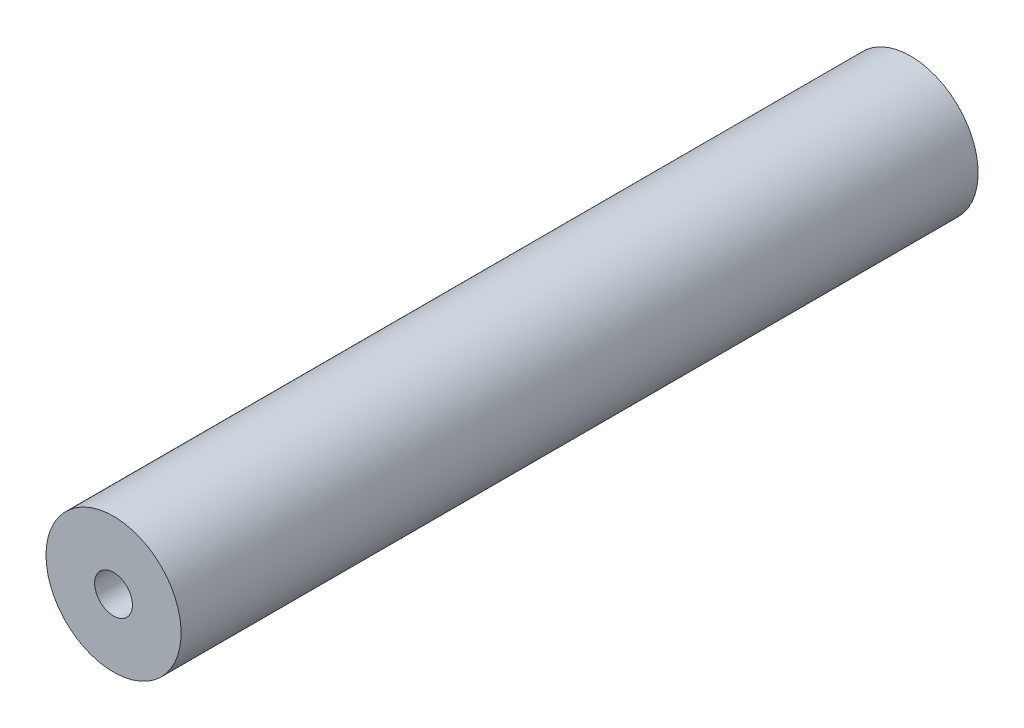
from build123d import *

# Parameters (mm, degrees)
SKETCH1_R           = 31.75
BOSS_EXTRUDE1_DEPTH = 374.65
SKETCH2_R           = 8.89
CUT_EXTRUDE1_DEPTH  = 378.331084725


with BuildPart() as part:
    # Sketch1 → Boss-Extrude1 (new body)
    with BuildSketch(Plane.XY):
        with Locations(Location((0, 0, 0), (0, 0, 180))):
            Circle(SKETCH1_R)
    extrude(amount=BOSS_EXTRUDE1_DEPTH)

    # Sketch2 → Cut-Extrude1 (cut, through all)
    with BuildSketch(Plane(origin=(0, 0, 0), x_dir=(-1, 0, 0), z_dir=(0, 0, -1))):
        Circle(SKETCH2_R)
    extrude(amount=-CUT_EXTRUDE1_DEPTH, mode=Mode.SUBTRACT)


solid = part.part
